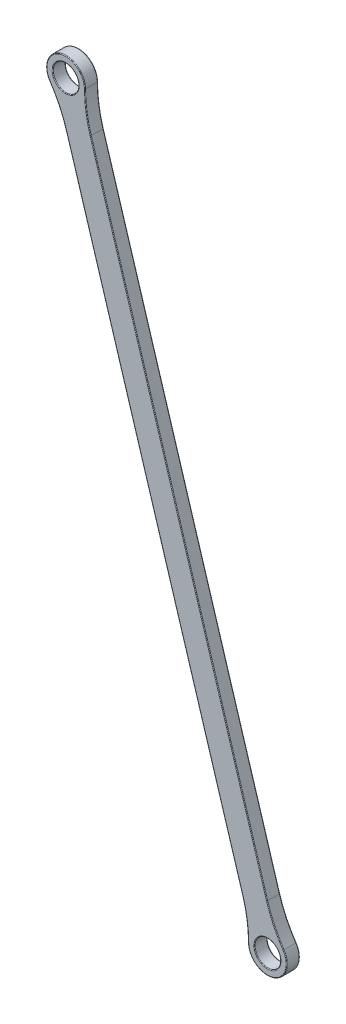
from build123d import *

# Parameters (mm, degrees)
EXTRUDE_1_DEPTH = 3
FILLET_1_R      = 30
FILLET_2_R      = 0.15


with BuildPart() as part:
    # 草图1 → 凸台-拉伸1 (new body)
    with BuildSketch(Plane.XY):
        with BuildLine():
            Line((-15.108353931, 208.338258003), (29.894233953, 61.801089253))
            ThreePointArc((29.894233953, 61.801089253), (32.425635759, 63.777218602), (35.62985083, 63.562537251))
            Line((35.62985083, 63.562537251), (-9.372737055, 210.099706001))
            ThreePointArc((-9.372737055, 210.099706001), (-11.90413886, 208.123576652), (-15.108353931, 208.338258003))
        make_face()
        with BuildLine():
            ThreePointArc((36.614530195, 60.356229944), (34.627445756, 56.607697507), (30.878913319, 58.594781946))
            Line((30.878913319, 58.594781946), (29.894233953, 61.801089253))
            ThreePointArc((29.894233953, 61.801089253), (32.539699619, 55.140405305), (38.246721757, 59.475505945))
            ThreePointArc((38.246721757, 59.475505945), (37.536450034, 61.90201776), (35.62985083, 63.562537251))
            Line((35.62985083, 63.562537251), (36.614530195, 60.356229944))
        make_face()
        with BuildLine():
            ThreePointArc((-8.725224859, 212.425289309), (-15.651736673, 216.215017586), (-15.108353931, 208.338258003))
            Line((-15.108353931, 208.338258003), (-16.093033297, 211.54456531))
            ThreePointArc((-16.093033297, 211.54456531), (-14.105948858, 215.293097747), (-10.357416421, 213.306013308))
            Line((-10.357416421, 213.306013308), (-9.372737055, 210.099706001))
            ThreePointArc((-9.372737055, 210.099706001), (-8.890124219, 211.218267171), (-8.725224859, 212.425289309))
        make_face()
        with BuildLine():
            Line((-16.093033297, 211.54456531), (-15.108353931, 208.338258003))
            ThreePointArc((-15.108353931, 208.338258003), (-11.90413886, 208.123576652), (-9.372737055, 210.099706001))
            Line((-9.372737055, 210.099706001), (-10.357416421, 213.306013308))
            ThreePointArc((-10.357416421, 213.306013308), (-12.34450086, 209.557480871), (-16.093033297, 211.54456531))
        make_face()
        with BuildLine():
            Line((29.894233953, 61.801089253), (30.878913319, 58.594781946))
            ThreePointArc((30.878913319, 58.594781946), (32.865997758, 62.343314383), (36.614530195, 60.356229944))
            Line((36.614530195, 60.356229944), (35.62985083, 63.562537251))
            ThreePointArc((35.62985083, 63.562537251), (32.425635759, 63.777218602), (29.894233953, 61.801089253))
        make_face()
    extrude(amount=-EXTRUDE_1_DEPTH)

    # 圆角1
    fillet_1_edges = [part.edges().sort_by_distance(p)[0] for p in [
        (29.894233953, 61.801089253, -1.5),
        (-15.108353931, 208.338258003, -1.5),
        (-9.372737055, 210.099706001, -1.5),
        (35.62985083, 63.562537251, -1.5),
    ]]
    fillet(fillet_1_edges, radius=FILLET_1_R)

    # 圆角2
    fillet_2_edges = [part.edges().sort_by_distance(p)[0] for p in [
        (-10.357416421, 213.306013308, 0),
        (-14.546310857, 216.727001966, 0),
        (-14.546310857, 216.727001966, -3),
        (7.392940011, 135.069673628, 0),
        (7.392940011, 135.069673628, -3),
        (13.128556887, 136.831121626, 0),
        (13.128556887, 136.831121626, -3),
        (33.751224503, 54.975508198, 0),
        (33.751224503, 54.975508198, -3),
        (-14.750982991, 206.05773937, 0),
        (-14.750982991, 206.05773937, -3),
        (-8.388503918, 208.011701126, 0),
        (30.878913319, 58.594781946, -3),
        (-8.388503918, 208.011701126, -3),
        (35.272479889, 65.843055884, 0),
        (35.272479889, 65.843055884, -3),
        (28.910000817, 63.889094128, 0),
        (28.910000817, 63.889094128, -3),
        (-10.357416421, 213.306013308, -3),
        (30.878913319, 58.594781946, 0),
    ]]
    fillet(fillet_2_edges, radius=FILLET_2_R)


solid = part.part
